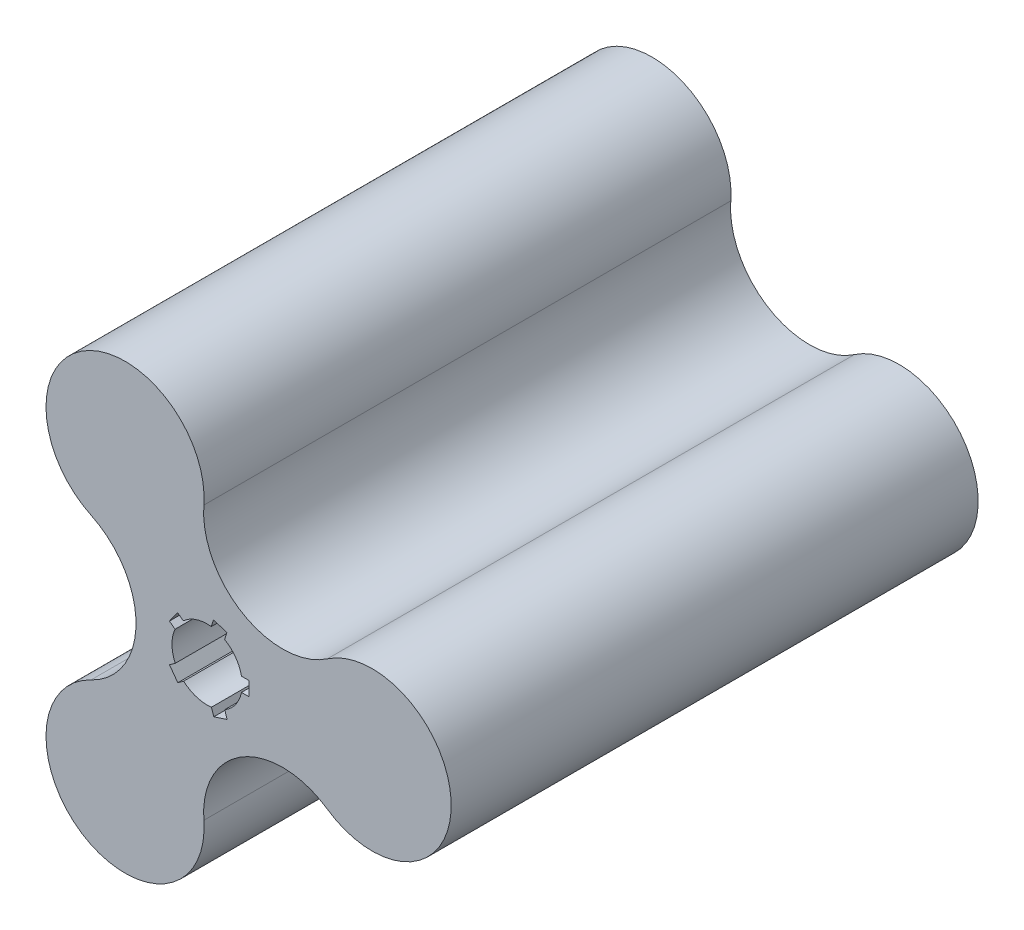
from build123d import *

# Parameters (mm, degrees)
BOSS_EXTRUDE1_DEPTH = 75


with BuildPart() as part:
    # Sketch1 → Boss-Extrude1 (new, symmetric)
    with BuildSketch(Plane.XY):
        with BuildLine():
            ThreePointArc((-0.917765177, -38.883932695), (10.262933143, -17.63377253), (34.256460841, -18.576083835))
            ThreePointArc((34.256460841, -18.576083835), (69.499988538, -0.032823555), (34.256460841, 18.510436725))
            ThreePointArc((34.256460841, 18.510436725), (10.262933143, 17.568125421), (-0.917765177, 38.818285585))
            ThreePointArc((-0.917765177, 38.818285585), (-34.598463498, 60.06844575), (-33.035634121, 20.275025305))
            ThreePointArc((-33.035634121, 20.275025305), (-20.222804743, -0.032823555), (-33.035634121, -20.340672415))
            ThreePointArc((-33.035634121, -20.340672415), (-34.598463498, -60.13409286), (-0.917765177, -38.883932695))
        make_face()
        with BuildLine():
            Line((1.907111414, -11.957316484), (1.245826983, -9.922092276))
            ThreePointArc((1.245826983, -9.922092276), (-2.974669232, -9.547321245), (-6.661121842, -7.458515657))
            Line((-6.661121842, -7.458515657), (-8.330592399, -8.671457016))
            Line((-8.330592399, -8.671457016), (-10.681733408, -5.435389039))
            Line((-10.681733408, -5.435389039), (-9.051488804, -4.250947003))
            ThreePointArc((-9.051488804, -4.250947003), (-9.99981681, -0.060529116), (-9.102285822, 4.141061797))
            Line((-9.102285822, 4.141061797), (-10.720319811, 5.316632302))
            Line((-10.720319811, 5.316632302), (-8.369178802, 8.552700279))
            Line((-8.369178802, 8.552700279), (-6.751144813, 7.377129775))
            ThreePointArc((-6.751144813, 7.377129775), (-3.054553816, 9.522063904), (1.199967545, 9.92774284))
            Line((1.199967545, 9.92774284), (1.844677303, 11.911955447))
            Line((1.844677303, 11.911955447), (5.648903368, 10.67588747))
            Line((5.648903368, 10.67588747), (4.994934057, 8.663176887))
            ThreePointArc((4.994934057, 8.663176887), (8.112145375, 5.847486418), (9.797958971, 2))
            Line((9.797958971, 2), (12, 2))
            Line((12, 2), (12, -2))
            Line((12, -2), (9.797958971, -2))
            ThreePointArc((9.797958971, -2), (8.125687266, -5.828653915), (5.035070067, -8.639911424))
            Line((5.035070067, -8.639911424), (5.71133748, -10.721248507))
            Line((5.71133748, -10.721248507), (1.907111414, -11.957316484))
        make_face(mode=Mode.SUBTRACT)
    extrude(amount=BOSS_EXTRUDE1_DEPTH, both=True)


solid = part.part
